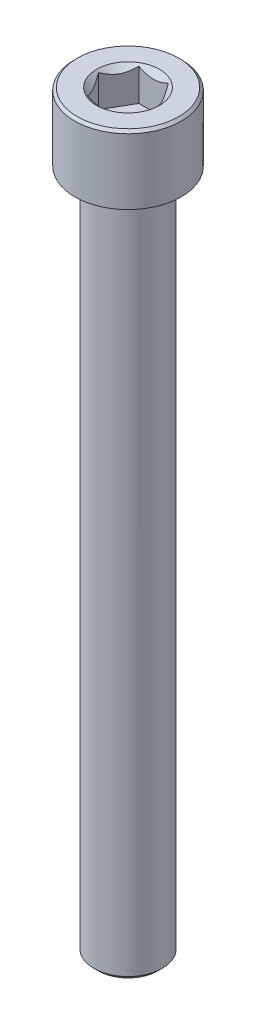
from build123d import *

# Parameters (mm, degrees)
WYCI_GNI_CIE1_DEPTH        = 4
SFAZOWANIE1_SIZE           = 0.3
SZKIC3_R                   = 3.68172134
WYTNIJ_WYCI_GNI_CIE1_DEPTH = 2
WYTNIJ_WYCI_GNI_CIE1_DRAFT = -45
SFAZOWANIE2_SIZE           = 0.5


with BuildPart() as part:
    # Szkic1 → Obrót1 (revolve)
    with BuildSketch(Plane.XY, mode=Mode.PRIVATE) as obr_t1_sk:
        Polygon((0, 0), (-4, 0), (-4, 80), (-6.25, 80), (-6.25, 88), (0, 88), align=None)
    revolve(obr_t1_sk.sketch.rotate(Axis((0, 0, 0), (0, 1, 0)), 270), axis=Axis((0, 0, 0), (0, 1, 0)))

    # Szkic2 → Wyciągnięcie1 (cut)
    with BuildSketch(Plane(origin=(0, 88, 0), x_dir=(1, 0, 0), z_dir=(0, 1, 0))):
        Polygon((3.464101615, 0), (1.732050808, 3), (-1.732050808, 3), (-3.464101615, 0), (-1.732050808, -3), (1.732050808, -3), align=None)
    extrude(amount=-WYCI_GNI_CIE1_DEPTH, mode=Mode.SUBTRACT)

    # Sfazowanie1
    sfazowanie1_edges = [part.edges().sort_by_distance(p)[0] for p in [
        (0, 88, 6.25),
    ]]
    chamfer(sfazowanie1_edges, length=SFAZOWANIE1_SIZE)


with BuildPart() as wytnij_wyci_gni_cie1_tool:
    # Szkic3 → Wytnij-wyciągnięcie1 (with draft: the straight prism first)
    with BuildSketch(Plane(origin=(0, 88, 0), x_dir=(1, 0, 0), z_dir=(0, 1, 0))):
        Circle(SZKIC3_R)
    extrude(amount=-WYTNIJ_WYCI_GNI_CIE1_DEPTH)
    # Wytnij-wyciągnięcie1: the draft: its side faces are tilted about the plane it starts from
    wytnij_wyci_gni_cie1_sides = [wytnij_wyci_gni_cie1_tool.faces().sort_by_distance(p)[0] for p in [
        (-3.68172134, 87, 0),
    ]]
    draft(wytnij_wyci_gni_cie1_sides, Plane(origin=(0, 88, 0), x_dir=(1, 0, 0), z_dir=(0, 1, 0)), WYTNIJ_WYCI_GNI_CIE1_DRAFT)


with BuildPart() as part_1:
    add(part.part)

    # Wytnij-wyciągnięcie1: cut by wytnij_wyci_gni_cie1_tool
    add(wytnij_wyci_gni_cie1_tool.part, mode=Mode.SUBTRACT)

    # Sfazowanie2
    sfazowanie2_edges = [part_1.edges().sort_by_distance(p)[0] for p in [
        (0, 0, 4),
    ]]
    chamfer(sfazowanie2_edges, length=SFAZOWANIE2_SIZE)


solid = part_1.part
